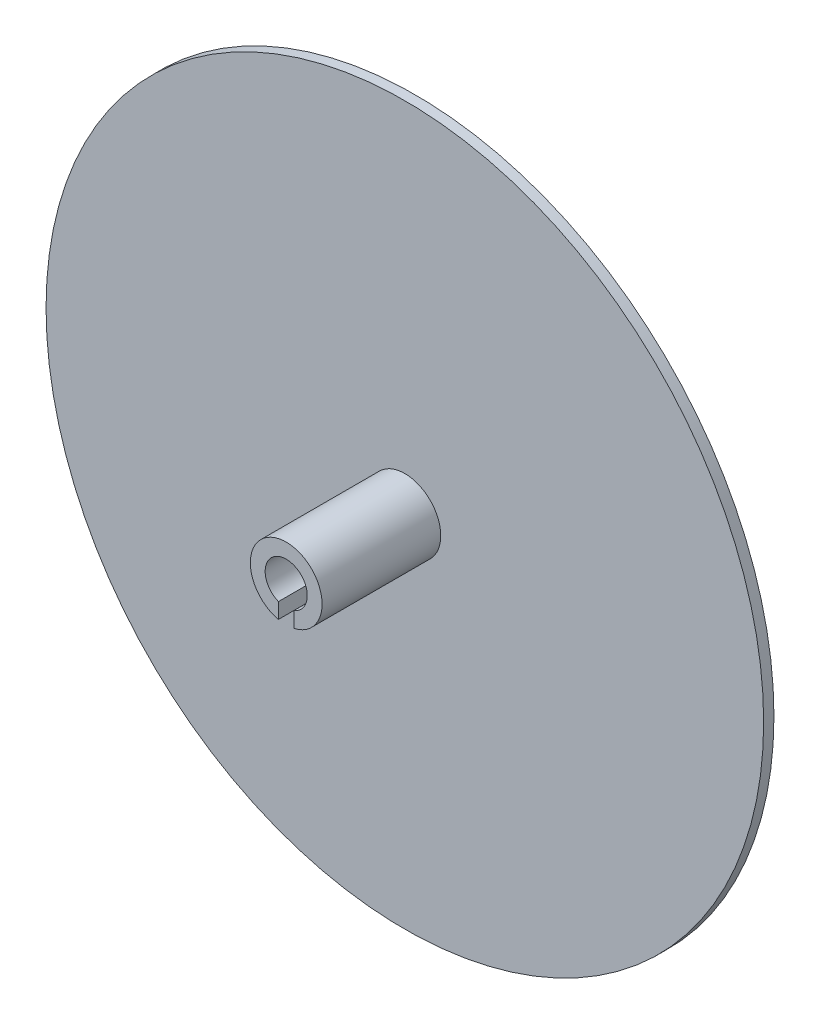
from build123d import *

# Parameters (mm, degrees)
SCHIZZO1_R                   = 150
ESTRUSIONE_ESTRUSIONE1_DEPTH = 4.3
SCHIZZO2_R                   = 15
SCHIZZO2_R_2                 = 8.8
ESTRUSIONE_ESTRUSIONE2_DEPTH = 49.6
TAGLIO_ESTRUSIONE1_START     = -17.25
TAGLIO_ESTRUSIONE1_DEPTH     = 17.25


with BuildPart() as part:
    # Schizzo1 → Estrusione-Estrusione1 (new body)
    with BuildSketch(Plane.XY):
        Circle(SCHIZZO1_R)
    extrude(amount=ESTRUSIONE_ESTRUSIONE1_DEPTH)

    # Schizzo2 → Estrusione-Estrusione2 (add)
    with BuildSketch(Plane.XY.offset(4.3)):
        with Locations(Location((0, 0, 0), (0, 0, 180))):
            Circle(SCHIZZO2_R)
        with Locations(Location((0, 0, 0), (0, 0, 180))):
            Circle(SCHIZZO2_R_2, mode=Mode.SUBTRACT)
    extrude(amount=ESTRUSIONE_ESTRUSIONE2_DEPTH)

    # Schizzo3 → Taglio-Estrusione1 (cut)
    with BuildSketch(Plane.XY.offset(53.9).offset(TAGLIO_ESTRUSIONE1_START)):
        with BuildLine():
            Line((0, -15), (0, -8.8))
            ThreePointArc((0, -8.8), (-1.654505223, -8.643067307), (-3.25, -8.17786647))
            Line((-3.25, -8.17786647), (-3.25, -14.643684646))
            ThreePointArc((-3.25, -14.643684646), (-1.63473703, -14.910655078), (0, -15))
        make_face()
        with BuildLine():
            ThreePointArc((3.25, -8.17786647), (1.654505223, -8.643067307), (0, -8.8))
            Line((0, -8.8), (0, -15))
            ThreePointArc((0, -15), (1.63473703, -14.910655078), (3.25, -14.643684646))
            Line((3.25, -14.643684646), (3.25, -8.17786647))
        make_face()
    extrude(amount=TAGLIO_ESTRUSIONE1_DEPTH, mode=Mode.SUBTRACT)


solid = part.part
